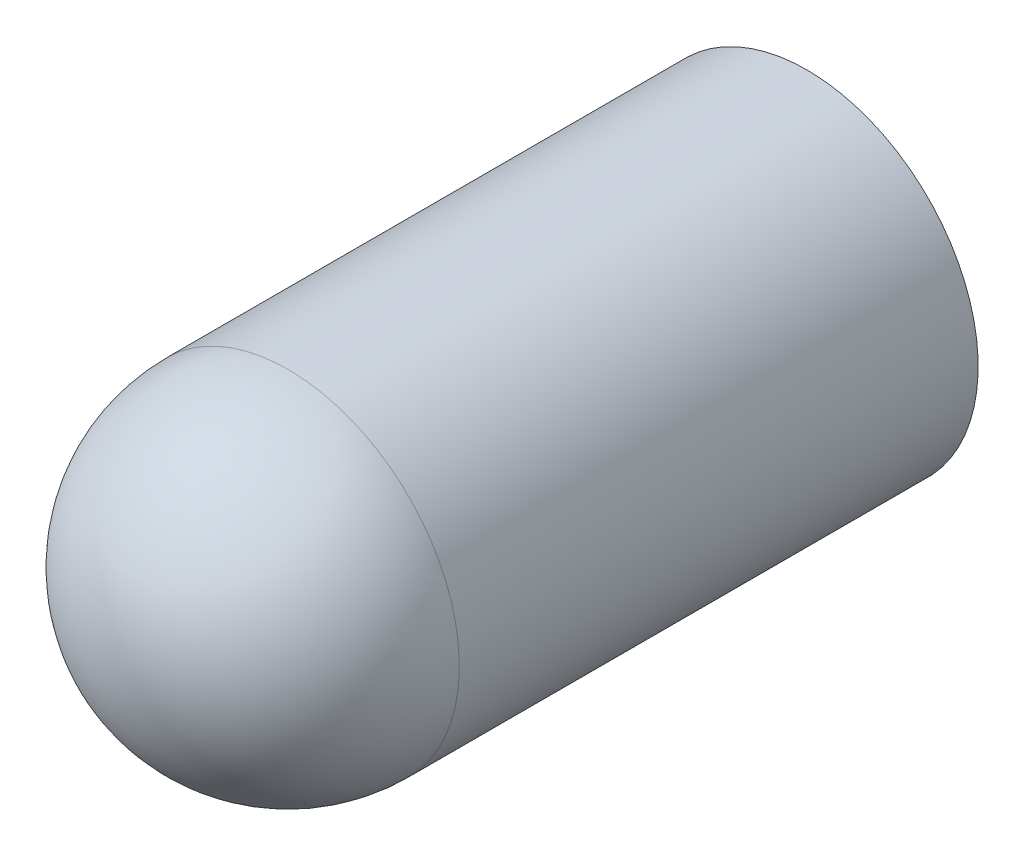
from build123d import *


with BuildPart() as part:
    # Sketch1 → Revolve2 (revolve)
    with BuildSketch(Plane(origin=(0, 0, 0), x_dir=(1, 0, 0), z_dir=(0, 1, 0)), mode=Mode.PRIVATE) as revolve2_sk:
        with BuildLine():
            Line((1.651, 0), (1.651, -12.7))
            ThreePointArc((1.651, -12.7), (1.167433296, -13.867433296), (0, -14.351))
            Line((0, -14.351), (0, -16.891))
            ThreePointArc((0, -16.891), (2.96348452, -15.66348452), (4.191, -12.7))
            Line((4.191, -12.7), (4.191, 0))
            Line((4.191, 0), (1.651, 0))
        make_face()
    revolve(revolve2_sk.sketch.rotate(Axis((0, 0, 0), (0, 0, 1)), 180), axis=Axis((0, 0, 0), (0, 0, 1)))


solid = part.part
